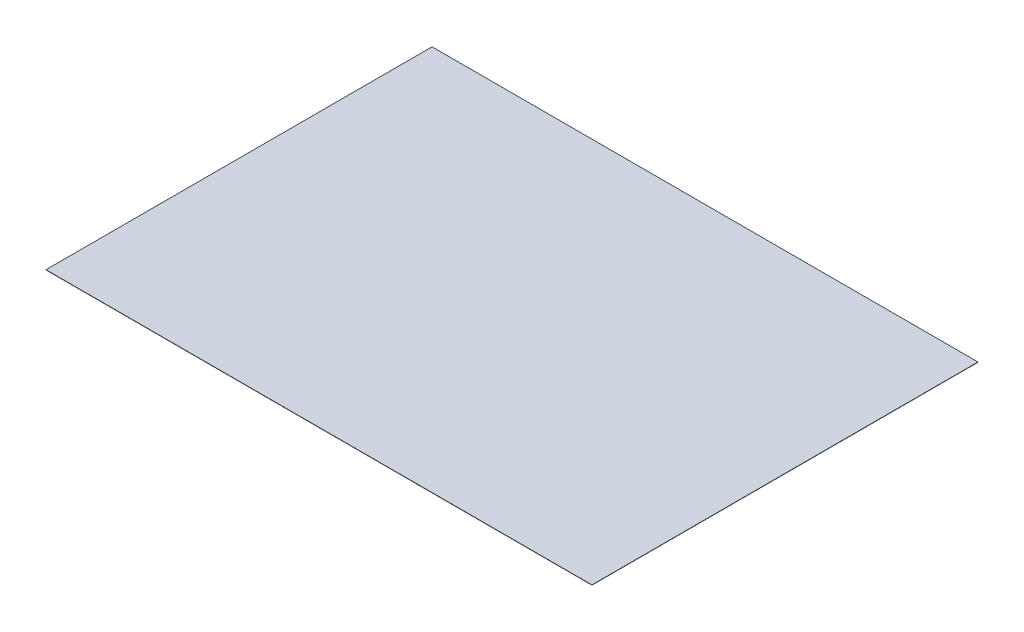
from build123d import *

# Parameters (mm, degrees)
SKETCH1_W           = 420
SKETCH1_H           = 297
BOSS_EXTRUDE1_DEPTH = 0.2


with BuildPart() as part:
    # Sketch1 → Boss-Extrude1 (new body)
    with BuildSketch(Plane(origin=(0, 0, 0), x_dir=(1, 0, 0), z_dir=(0, 1, 0))):
        Rectangle(SKETCH1_W, SKETCH1_H)
    extrude(amount=BOSS_EXTRUDE1_DEPTH)


solid = part.part
